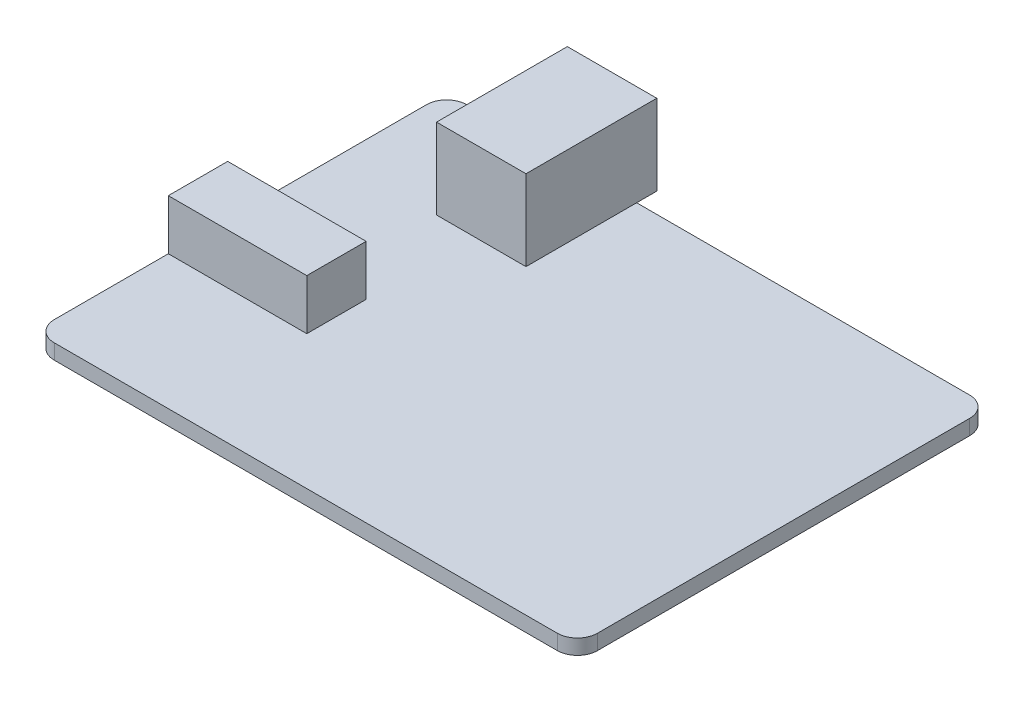
from build123d import *

# Parameters (mm, degrees)
SKETCH1_W           = 54
SKETCH1_H           = 41
BOSS_EXTRUDE1_DEPTH = 1.5
SKETCH2_W           = 8.89
SKETCH2_H           = 13
BOSS_EXTRUDE2_DEPTH = 8
FILLET1_R           = 2
SKETCH3_W           = 13.765008066
SKETCH3_H           = 5.90131675
BOSS_EXTRUDE3_DEPTH = 5
SKETCH4_R           = 1.5875
CUT_EXTRUDE1_DEPTH  = 10


with BuildPart() as part:
    # Sketch1 → Boss-Extrude1 (new body)
    with BuildSketch(Plane(origin=(0, 0, 0), x_dir=(1, 0, 0), z_dir=(0, 1, 0))):
        with Locations((27, 20.5)):
            Rectangle(SKETCH1_W, SKETCH1_H)
    extrude(amount=BOSS_EXTRUDE1_DEPTH)

    # Sketch2 → Boss-Extrude2 (add)
    with BuildSketch(Plane(origin=(0, 1.5, 0), x_dir=(1, 0, 0), z_dir=(0, 1, 0))):
        with Locations((14.445, 36.5)):
            Rectangle(SKETCH2_W, SKETCH2_H)
    extrude(amount=BOSS_EXTRUDE2_DEPTH)

    # Fillet1
    fillet1_edges = [part.edges().sort_by_distance(p)[0] for p in [
        (0, 0.75, -41),
        (54, 0.75, -41),
        (54, 0.75, 0),
        (0, 0.75, 0),
    ]]
    fillet(fillet1_edges, radius=FILLET1_R)

    # Sketch3 → Boss-Extrude3 (add)
    with BuildSketch(Plane(origin=(0, 1.5, 0), x_dir=(1, 0, 0), z_dir=(0, 1, 0))):
        with Locations((6.882504033, 16.286215299)):
            Rectangle(SKETCH3_W, SKETCH3_H)
    extrude(amount=BOSS_EXTRUDE3_DEPTH)

    # Sketch4 → Cut-Extrude1 (cut)
    with BuildSketch(Plane.ZY):
        with Locations((-16.286215299, 4)):
            Circle(SKETCH4_R)
    extrude(amount=-CUT_EXTRUDE1_DEPTH, mode=Mode.SUBTRACT)


solid = part.part
